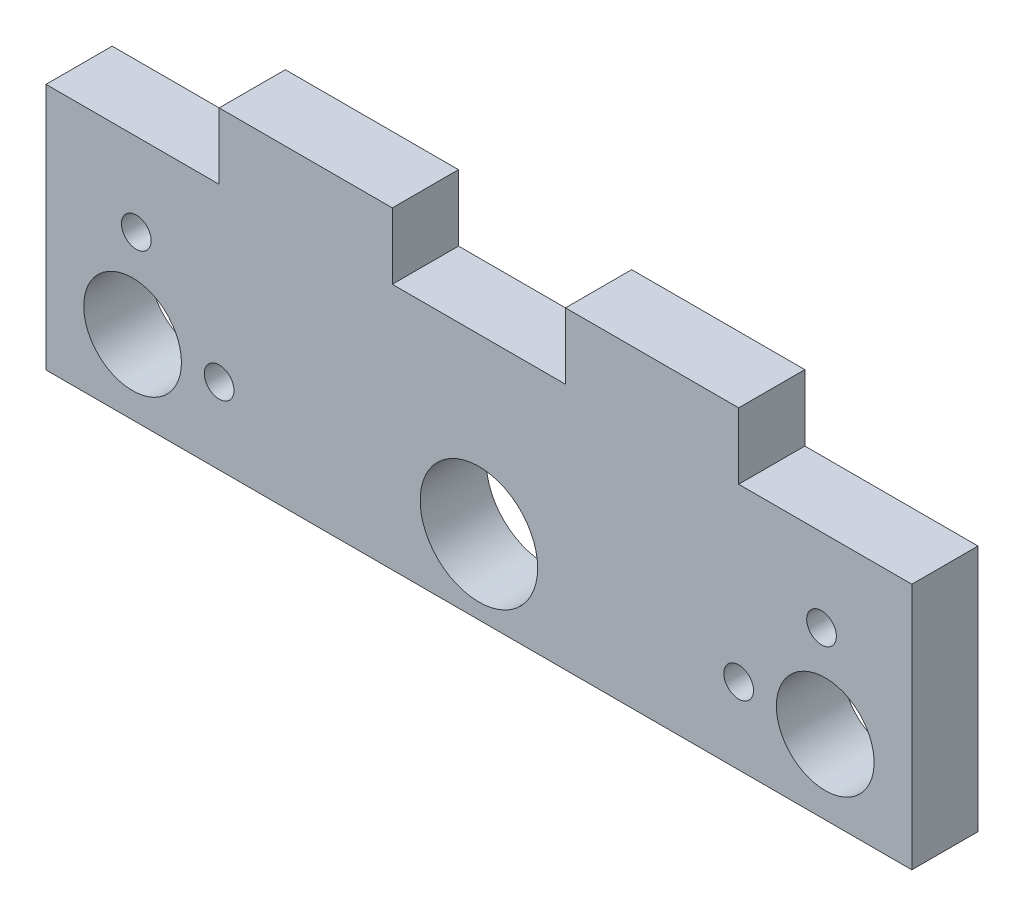
from build123d import *

# Parameters (mm, degrees)
MODEL_R             = 4.75
MODEL_R_2           = 3.95
MODEL_R_3           = 1.2
BOSS_EXTRUDE1_DEPTH = 5.35


with BuildPart() as part:
    # Model → Boss-Extrude1 (new body)
    with BuildSketch(Plane.XY):
        Polygon((-35, 0), (35, 0), (35, 20), (21, 20), (21, 25.35), (7, 25.35), (7, 20), (-7, 20), (-7, 25.35), (-21, 25.35), (-21, 20), (-35, 20), align=None)
        with Locations((0, 6)):
            Circle(MODEL_R, mode=Mode.SUBTRACT)
        with Locations((-28, 6)):
            Circle(MODEL_R_2, mode=Mode.SUBTRACT)
        with Locations((-27.7, 13.3)):
            Circle(MODEL_R_3, mode=Mode.SUBTRACT)
        with Locations((-21, 6.16)):
            Circle(MODEL_R_3, mode=Mode.SUBTRACT)
        with Locations(Location((21, 6.16, 0), (0, 0, 180))):
            Circle(MODEL_R_3, mode=Mode.SUBTRACT)
        with Locations(Location((28, 6, 0), (0, 0, 180))):
            Circle(MODEL_R_2, mode=Mode.SUBTRACT)
        with Locations(Location((27.7, 13.3, 0), (0, 0, 180))):
            Circle(MODEL_R_3, mode=Mode.SUBTRACT)
    extrude(amount=BOSS_EXTRUDE1_DEPTH)


solid = part.part
